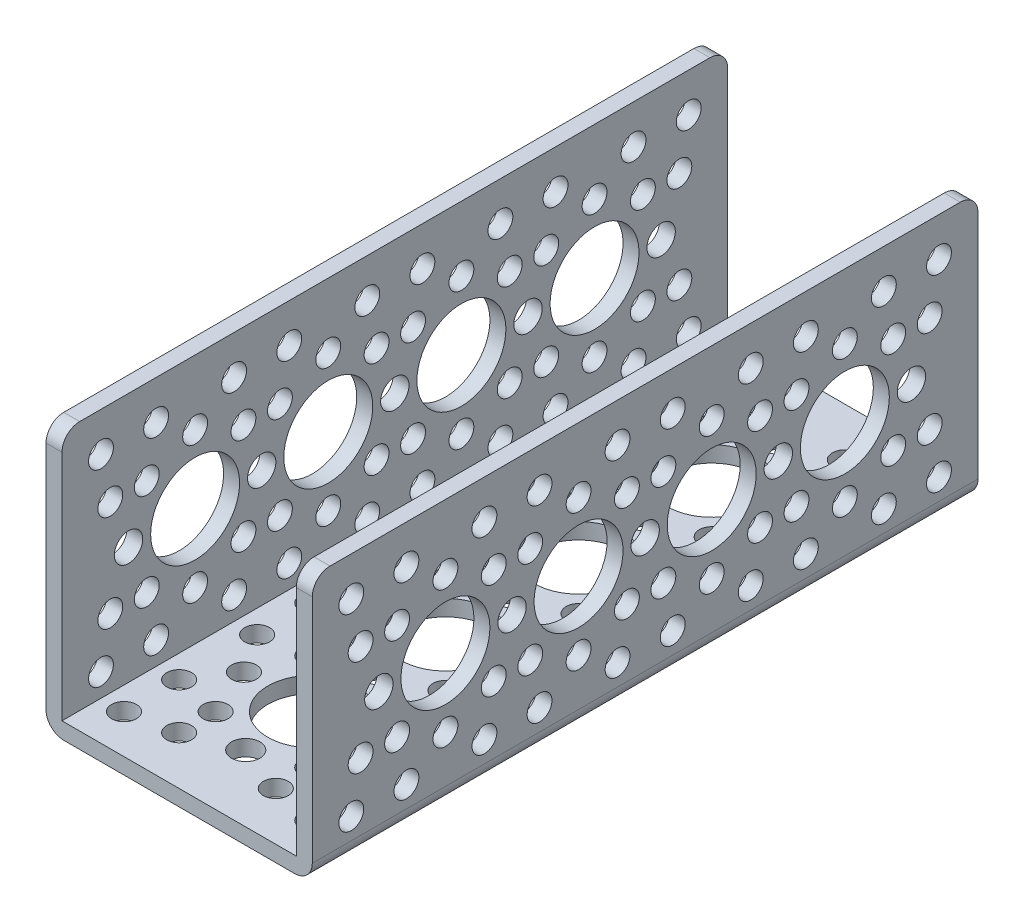
from build123d import *

# Parameters (mm, degrees)
SKETCH1_W                 = 38.1
SKETCH1_H                 = 95.25
BOSS_EXTRUDE1_DEPTH       = 38.1
SKETCH2_W                 = 33.528
SKETCH2_H                 = 35.814
CUT_EXTRUDE1_DEPTH        = 110.433918417
HOLE1_D                   = 12.7254
HOLE1_DEPTH               = 2.286
F_5_CLEARANCE_HOLE1_D     = 3.556
F_5_CLEARANCE_HOLE1_DEPTH = 2.286
F_6_CLEARANCE_HOLE1_D     = 4.064
F_6_CLEARANCE_HOLE1_DEPTH = 2.286
HOLE2_D                   = 12.7254
HOLE2_DEPTH               = 38.1
F_6_CLEARANCE_HOLE2_D     = 4.064
F_6_CLEARANCE_HOLE2_DEPTH = 38.1
F_5_CLEARANCE_HOLE2_D     = 3.556
F_5_CLEARANCE_HOLE2_DEPTH = 38.1
HOLE3_D                   = 12.7254
HOLE3_DEPTH               = 38.1
F_5_CLEARANCE_HOLE3_D     = 3.556
F_5_CLEARANCE_HOLE3_DEPTH = 38.1
F_6_CLEARANCE_HOLE3_D     = 4.064
F_6_CLEARANCE_HOLE3_DEPTH = 38.1
FILLET1_R                 = 2.54


with BuildPart() as part:
    # Sketch1 → Boss-Extrude1 (new body)
    with BuildSketch(Plane.XZ):
        with Locations((19.05, 47.625)):
            Rectangle(SKETCH1_W, SKETCH1_H)
    extrude(amount=-BOSS_EXTRUDE1_DEPTH)

    # Sketch2 → Cut-Extrude1 (cut, through all)
    with BuildSketch(Plane.XY.offset(95.25)):
        with Locations((19.05, 20.193)):
            Rectangle(SKETCH2_W, SKETCH2_H)
    extrude(amount=-CUT_EXTRUDE1_DEPTH, mode=Mode.SUBTRACT)

    # Hole1
    with Locations(Plane(origin=(38.1, 0, 0), x_dir=(0, 0, -1), z_dir=(1, 0, 0))):
        with Locations((-38.1, 19.05), (-19.05, 19.05), (-57.15, 19.05), (-76.2, 19.05)):
            Hole(HOLE1_D / 2, depth=HOLE1_DEPTH)

    # #5 Clearance Hole1
    with Locations(Plane(origin=(38.1, 0, 0), x_dir=(0, 0, -1), z_dir=(1, 0, 0))):
        with Locations((-81.779615818, 5.579615818), (-88.335202787, 12.135202787), (-81.779615818, 32.520384182), (-88.335202787, 25.964797213), (-13.470384182, 5.579615818), (-6.914797213, 12.135202787), (-13.470384182, 32.520384182), (-6.914797213, 25.964797213), (-62.729615818, 5.579615818), (-43.679615818, 5.579615818), (-24.629615818, 5.579615818), (-62.729615818, 32.520384182), (-43.679615818, 32.520384182), (-24.629615818, 32.520384182), (-89.670384182, 5.579615818), (-89.670384182, 32.520384182), (-70.620384182, 5.579615818), (-70.620384182, 32.520384182), (-51.570384182, 5.579615818), (-51.570384182, 32.520384182), (-38.1, 9.271), (-45.014797213, 12.135202787), (-45.014797213, 25.964797213), (-38.1, 28.829), (-31.185202787, 25.964797213), (-31.185202787, 12.135202787), (-32.520384182, 5.579615818), (-32.520384182, 32.520384182), (-5.579615818, 5.579615818), (-5.579615818, 32.520384182), (-12.135202787, 12.135202787), (-19.05, 9.271), (-25.964797213, 12.135202787), (-25.964797213, 25.964797213), (-19.05, 28.829), (-12.135202787, 25.964797213), (-50.235202787, 12.135202787), (-69.285202787, 12.135202787), (-50.235202787, 25.964797213), (-69.285202787, 25.964797213), (-57.15, 28.829), (-76.2, 28.829), (-64.064797213, 25.964797213), (-83.114797213, 25.964797213), (-64.064797213, 12.135202787), (-83.114797213, 12.135202787), (-57.15, 9.271), (-76.2, 9.271)):
            Hole(F_5_CLEARANCE_HOLE1_D / 2, depth=F_5_CLEARANCE_HOLE1_DEPTH)

    # #6 Clearance Hole1
    with Locations(Plane(origin=(38.1, 0, 0), x_dir=(0, 0, -1), z_dir=(1, 0, 0))):
        with Locations((-85.725, 19.05), (-66.675, 19.05), (-47.625, 19.05), (-28.575, 19.05), (-9.525, 19.05)):
            Hole(F_6_CLEARANCE_HOLE1_D / 2, depth=F_6_CLEARANCE_HOLE1_DEPTH)

    # Hole2
    with Locations(Plane(origin=(0, 0, 0), x_dir=(-1, 0, 0), z_dir=(0, -1, 0))):
        with Locations((-19.05, -76.2), (-19.05, -57.15), (-19.05, -38.1), (-19.05, -19.05)):
            Hole(HOLE2_D / 2, depth=HOLE2_DEPTH)

    # #6 Clearance Hole2
    with Locations(Plane(origin=(0, 0, 0), x_dir=(-1, 0, 0), z_dir=(0, -1, 0))):
        with Locations((-19.05, -85.725), (-19.05, -66.675), (-19.05, -47.625), (-19.05, -28.575), (-19.05, -9.525)):
            Hole(F_6_CLEARANCE_HOLE2_D / 2, depth=F_6_CLEARANCE_HOLE2_DEPTH)

    # #5 Clearance Hole2
    with Locations(Plane(origin=(0, 0, 0), x_dir=(-1, 0, 0), z_dir=(0, -1, 0))):
        with Locations((-5.579615818, -89.670384182), (-5.579615818, -81.779615818), (-12.135202787, -88.335202787), (-32.520384182, -89.670384182), (-32.520384182, -81.779615818), (-25.964797213, -88.335202787), (-5.579615818, -70.620384182), (-5.579615818, -62.729615818), (-32.520384182, -70.620384182), (-32.520384182, -62.729615818), (-5.579615818, -51.570384182), (-5.579615818, -43.679615818), (-32.520384182, -51.570384182), (-32.520384182, -43.679615818), (-12.135202787, -69.285202787), (-9.271, -76.2), (-12.135202787, -83.114797213), (-25.964797213, -83.114797213), (-28.829, -76.2), (-25.964797213, -69.285202787), (-12.135202787, -50.235202787), (-9.271, -57.15), (-12.135202787, -64.064797213), (-25.964797213, -64.064797213), (-28.829, -57.15), (-25.964797213, -50.235202787), (-9.271, -38.1), (-12.135202787, -45.014797213), (-25.964797213, -45.014797213), (-28.829, -38.1), (-5.579615818, -32.520384182), (-5.579615818, -24.629615818), (-12.135202787, -31.185202787), (-32.520384182, -32.520384182), (-32.520384182, -24.629615818), (-25.964797213, -31.185202787), (-5.579615818, -5.579615818), (-5.579615818, -13.470384182), (-12.135202787, -6.914797213), (-32.520384182, -5.579615818), (-32.520384182, -13.470384182), (-25.964797213, -6.914797213), (-12.135202787, -12.135202787), (-9.271, -19.05), (-12.135202787, -25.964797213), (-25.964797213, -25.964797213), (-28.829, -19.05), (-25.964797213, -12.135202787)):
            Hole(F_5_CLEARANCE_HOLE2_D / 2, depth=F_5_CLEARANCE_HOLE2_DEPTH)

    # Hole3
    with Locations(Plane.ZY):
        with Locations((38.1, 19.05), (19.05, 19.05), (57.15, 19.05), (76.2, 19.05)):
            Hole(HOLE3_D / 2, depth=HOLE3_DEPTH)

    # #5 Clearance Hole3
    with Locations(Plane.ZY):
        with Locations((81.779615818, 5.579615818), (88.335202787, 12.135202787), (81.779615818, 32.520384182), (88.335202787, 25.964797213), (13.470384182, 5.579615818), (6.914797213, 12.135202787), (13.470384182, 32.520384182), (6.914797213, 25.964797213), (62.729615818, 5.579615818), (43.679615818, 5.579615818), (24.629615818, 5.579615818), (62.729615818, 32.520384182), (43.679615818, 32.520384182), (24.629615818, 32.520384182), (89.670384182, 5.579615818), (89.670384182, 32.520384182), (70.620384182, 5.579615818), (70.620384182, 32.520384182), (51.570384182, 5.579615818), (51.570384182, 32.520384182), (31.185202787, 12.135202787), (38.1, 9.271), (45.014797213, 12.135202787), (45.014797213, 25.964797213), (38.1, 28.829), (31.185202787, 25.964797213), (32.520384182, 5.579615818), (32.520384182, 32.520384182), (5.579615818, 5.579615818), (5.579615818, 32.520384182), (12.135202787, 12.135202787), (19.05, 9.271), (25.964797213, 12.135202787), (25.964797213, 25.964797213), (19.05, 28.829), (12.135202787, 25.964797213), (50.235202787, 25.964797213), (69.285202787, 25.964797213), (57.15, 28.829), (76.2, 28.829), (64.064797213, 25.964797213), (83.114797213, 25.964797213), (64.064797213, 12.135202787), (83.114797213, 12.135202787), (57.15, 9.271), (76.2, 9.271), (50.235202787, 12.135202787), (69.285202787, 12.135202787)):
            Hole(F_5_CLEARANCE_HOLE3_D / 2, depth=F_5_CLEARANCE_HOLE3_DEPTH)

    # #6 Clearance Hole3
    with Locations(Plane.ZY):
        with Locations((85.725, 19.05), (66.675, 19.05), (47.625, 19.05), (28.575, 19.05), (9.525, 19.05)):
            Hole(F_6_CLEARANCE_HOLE3_D / 2, depth=F_6_CLEARANCE_HOLE3_DEPTH)

    # Fillet1
    fillet1_edges = [part.edges().sort_by_distance(p)[0] for p in [
        (1.143, 38.1, 0),
        (36.957, 38.1, 0),
        (1.143, 38.1, 95.25),
        (0, 0, 47.625),
        (38.1, 0, 47.625),
        (36.957, 38.1, 95.25),
    ]]
    fillet(fillet1_edges, radius=FILLET1_R)


solid = part.part
